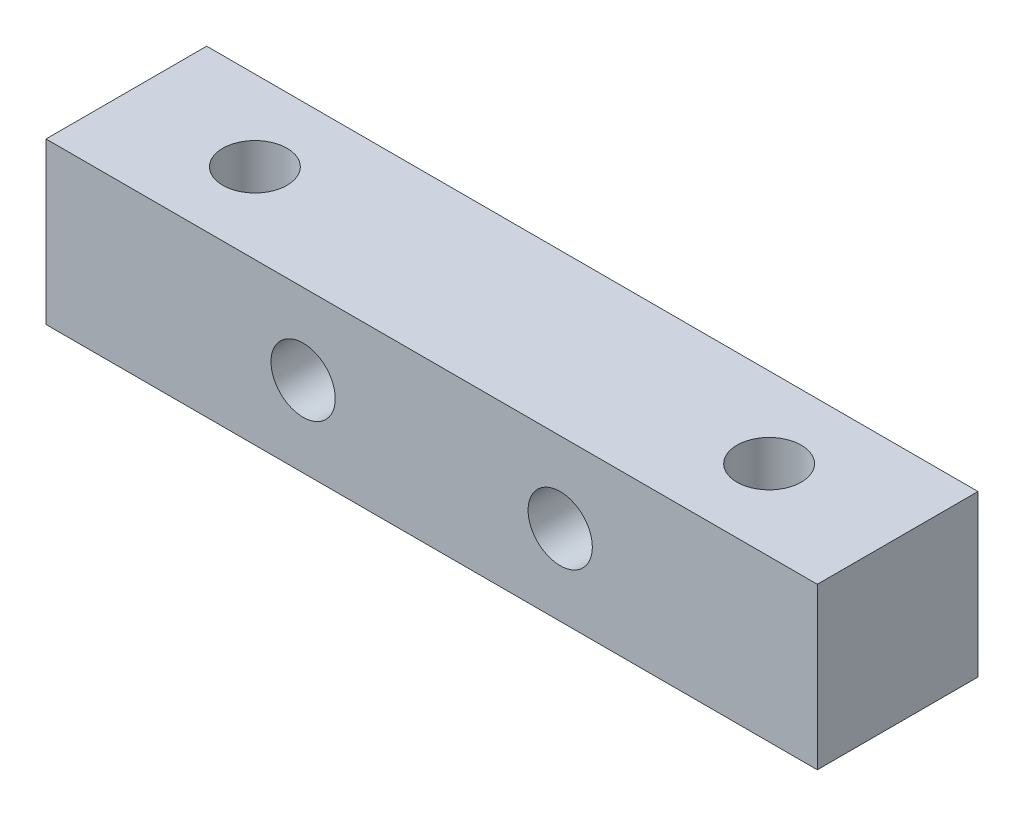
from build123d import *

# Parameters (mm, degrees)
SKETCH_1_W          = 48
SKETCH_1_H          = 10
SKETCH_1_R          = 2
EXTRUDE_1_DEPTH     = 10
SKETCH_2_R          = 2
CUT_EXTRUDE_1_DEPTH = 10


with BuildPart() as part:
    # 草图1 → 凸台-拉伸1 (new body)
    with BuildSketch(Plane(origin=(0, 0, 0), x_dir=(1, 0, 0), z_dir=(0, 1, 0))):
        Rectangle(SKETCH_1_W, SKETCH_1_H)
        with Locations(Location((16, 0, 0), (0, 0, 270))):
            Circle(SKETCH_1_R, mode=Mode.SUBTRACT)
        with Locations(Location((-16, 0, 0), (0, 0, 270))):
            Circle(SKETCH_1_R, mode=Mode.SUBTRACT)
    extrude(amount=EXTRUDE_1_DEPTH)

    # 草图2 → 切除-拉伸1 (cut)
    with BuildSketch(Plane.XY.offset(5)):
        with Locations((-8, 5)):
            Circle(SKETCH_2_R)
        with Locations((8, 5)):
            Circle(SKETCH_2_R)
    extrude(amount=-CUT_EXTRUDE_1_DEPTH, mode=Mode.SUBTRACT)


solid = part.part
